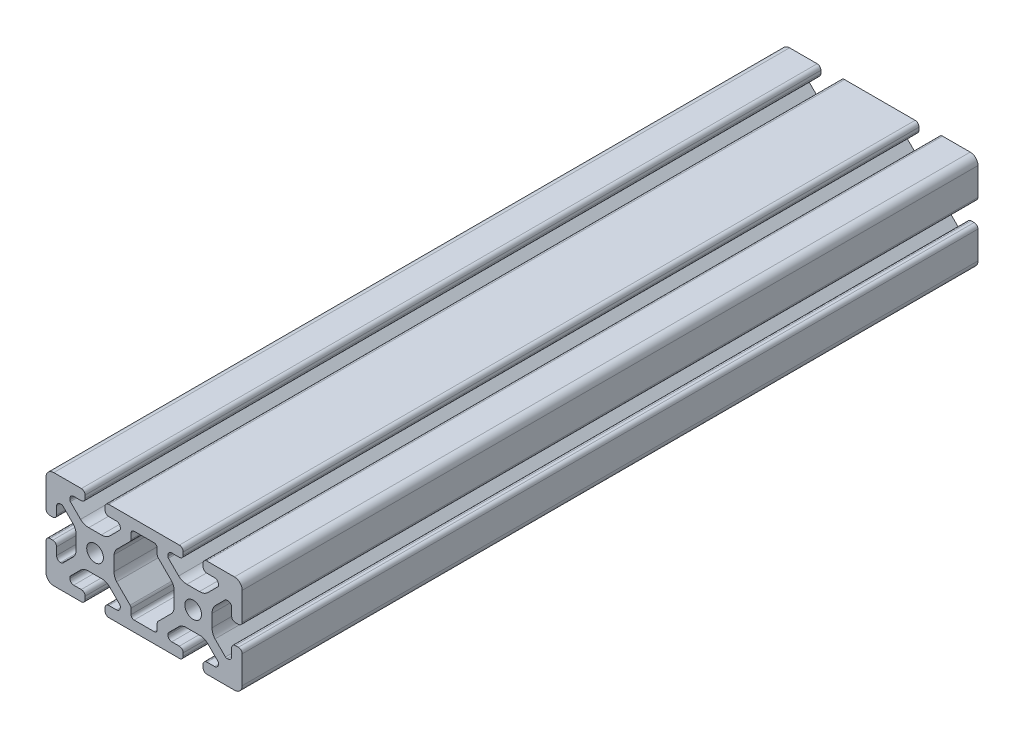
from build123d import *

# Parameters (mm, degrees)
SKETCH1_R      = 3.4
EXTRUDE1_DEPTH = 300


with BuildPart() as part:
    # Sketch1 → Extrude1 (new body)
    with BuildSketch(Plane.XY):
        with BuildLine():
            Line((-34.371895096, 20), (-5.628104904, 20))
            ThreePointArc((-5.628104904, 20), (-4.49100916, 19.51254943), (-4.06, 18.352883145))
            Line((-4.06, 18.352883145), (-4.06, 17.172883145))
            ThreePointArc((-4.06, 17.172883145), (-4.546241568, 16.112250378), (-5.63, 15.68))
            Line((-5.63, 15.68), (-8.715, 15.68))
            ThreePointArc((-8.715, 15.68), (-9.825157646, 15.220157646), (-10.285, 14.11))
            Line((-10.285, 14.11), (-10.285, 13.654503602))
            ThreePointArc((-10.285, 13.654503602), (-10.227148445, 13.363664194), (-10.062401154, 13.117102448))
            Line((-10.062401154, 13.117102448), (-5.908127218, 8.962828513))
            ThreePointArc((-5.908127218, 8.962828513), (-4.352583366, 8.002049766), (-2.549370008, 7.7))
            Line((-2.549370008, 7.7), (2.549370008, 7.7))
            ThreePointArc((2.549370008, 7.7), (4.352583366, 8.002049766), (5.908127218, 8.962828513))
            Line((5.908127218, 8.962828513), (10.062401154, 13.117102448))
            ThreePointArc((10.062401154, 13.117102448), (10.227148445, 13.363664194), (10.285, 13.654503602))
            Line((10.285, 13.654503602), (10.285, 14.11))
            ThreePointArc((10.285, 14.11), (9.825157646, 15.220157646), (8.715, 15.68))
            Line((8.715, 15.68), (5.63, 15.68))
            ThreePointArc((5.63, 15.68), (4.519842354, 16.139842354), (4.06, 17.25))
            Line((4.06, 17.25), (4.06, 18.431164164))
            ThreePointArc((4.06, 18.431164164), (4.498672143, 19.519739968), (5.569550674, 20))
            Line((5.569550674, 20), (13, 20))
            Line((13, 20), (16.83, 20))
            ThreePointArc((16.83, 20), (19.067780363, 19.075288119), (20, 16.840624931))
            Line((20, 16.840624931), (20, 13.010624931))
            Line((20, 13.010624931), (20, 5.582508737))
            ThreePointArc((20, 5.582508737), (19.486387554, 4.464397964), (18.324306777, 4.06))
            Line((18.324306777, 4.06), (17.144306789, 4.06))
            ThreePointArc((17.144306789, 4.06), (16.103082753, 4.554299861), (15.68, 5.626438298))
            Line((15.68, 5.626438298), (15.68, 8.711438298))
            ThreePointArc((15.68, 8.711438298), (15.220157646, 9.821595945), (14.11, 10.281438298))
            Line((14.11, 10.281438298), (13.650941901, 10.281438298))
            ThreePointArc((13.650941901, 10.281438298), (13.360102492, 10.223586743), (13.113540747, 10.058839452))
            Line((13.113540747, 10.058839452), (9.01112516, 5.956423865))
            ThreePointArc((9.01112516, 5.956423865), (8.027864944, 4.392105869), (7.715866667, 2.570966522))
            Line((7.715866667, 2.570966522), (7.715866667, -2.502014759))
            ThreePointArc((7.715866667, -2.502014759), (7.988460835, -4.298258683), (8.915473265, -5.86077197))
            Line((8.915473265, -5.86077197), (13.171894658, -10.117193363))
            ThreePointArc((13.171894658, -10.117193363), (13.418456403, -10.281940654), (13.709295811, -10.339792209))
            Line((13.709295811, -10.339792209), (14.110956402, -10.339792209))
            ThreePointArc((14.110956402, -10.339792209), (15.240319888, -9.860405851), (15.68, -8.714999999))
            Line((15.68, -8.714999999), (15.68, -5.629999999))
            ThreePointArc((15.68, -5.629999999), (16.139842353, -4.519842353), (17.249999999, -4.06))
            Line((17.249999999, -4.06), (18.431164165, -4.06))
            ThreePointArc((18.431164165, -4.06), (19.519739968, -4.498672143), (20, -5.569550674))
            Line((20, -5.569550674), (20, -13))
            Line((20, -13), (20, -16.83))
            ThreePointArc((20, -16.83), (19.153330856, -18.99480488), (17.057427332, -20))
            Line((17.057427332, -20), (13.227427332, -20))
            Line((13.227427332, -20), (5.796978006, -20))
            ThreePointArc((5.796978006, -20), (4.580537154, -19.606606664), (4.06, -18.438904761))
            Line((4.06, -18.438904761), (4.06, -17.25))
            ThreePointArc((4.06, -17.25), (4.519842354, -16.139842354), (5.63, -15.68))
            Line((5.63, -15.68), (8.715, -15.68))
            ThreePointArc((8.715, -15.68), (9.825157646, -15.220157646), (10.285, -14.11))
            Line((10.285, -14.11), (10.285, -13.654503602))
            ThreePointArc((10.285, -13.654503602), (10.227148445, -13.363664194), (10.062401154, -13.117102448))
            Line((10.062401154, -13.117102448), (6.309520343, -9.364221638))
            ThreePointArc((6.309520343, -9.364221638), (4.979669869, -8.257223741), (3.341546451, -7.7))
            Line((3.341546451, -7.7), (-3.341546451, -7.7))
            ThreePointArc((-3.341546451, -7.7), (-4.979669869, -8.257223741), (-6.309520343, -9.364221638))
            Line((-6.309520343, -9.364221638), (-10.062401154, -13.117102448))
            ThreePointArc((-10.062401154, -13.117102448), (-10.227148445, -13.363664194), (-10.285, -13.654503602))
            Line((-10.285, -13.654503602), (-10.285, -14.11))
            ThreePointArc((-10.285, -14.11), (-9.825157646, -15.220157646), (-8.715, -15.68))
            Line((-8.715, -15.68), (-5.63, -15.68))
            ThreePointArc((-5.63, -15.68), (-4.519842354, -16.139842354), (-4.06, -17.25))
            Line((-4.06, -17.25), (-4.06, -18.43))
            ThreePointArc((-4.06, -18.43), (-4.519842354, -19.540157646), (-5.63, -20))
            Line((-5.63, -20), (-14.00899397, -20))
            Line((-14.00899397, -20), (-21.780052417, -20))
            Line((-21.780052417, -20), (-25.99100603, -20))
            Line((-25.99100603, -20), (-34.37, -20))
            ThreePointArc((-34.37, -20), (-35.480157646, -19.540157646), (-35.94, -18.43))
            Line((-35.94, -18.43), (-35.94, -17.25))
            ThreePointArc((-35.94, -17.25), (-35.480157646, -16.139842354), (-34.37, -15.68))
            Line((-34.37, -15.68), (-31.285, -15.68))
            ThreePointArc((-31.285, -15.68), (-30.174842354, -15.220157646), (-29.715, -14.11))
            Line((-29.715, -14.11), (-29.715, -13.654503602))
            ThreePointArc((-29.715, -13.654503602), (-29.772851555, -13.363664194), (-29.937598846, -13.117102448))
            Line((-29.937598846, -13.117102448), (-33.690479657, -9.364221638))
            ThreePointArc((-33.690479657, -9.364221638), (-35.020330131, -8.257223741), (-36.658453549, -7.7))
            Line((-36.658453549, -7.7), (-43.341546451, -7.7))
            ThreePointArc((-43.341546451, -7.7), (-44.979669869, -8.257223741), (-46.309520343, -9.364221638))
            Line((-46.309520343, -9.364221638), (-50.062401154, -13.117102448))
            ThreePointArc((-50.062401154, -13.117102448), (-50.227148445, -13.363664194), (-50.285, -13.654503602))
            Line((-50.285, -13.654503602), (-50.285, -14.11))
            ThreePointArc((-50.285, -14.11), (-49.825157646, -15.220157646), (-48.715, -15.68))
            Line((-48.715, -15.68), (-45.63, -15.68))
            ThreePointArc((-45.63, -15.68), (-44.519842354, -16.139842354), (-44.06, -17.25))
            Line((-44.06, -17.25), (-44.06, -18.438904761))
            ThreePointArc((-44.06, -18.438904761), (-44.580537154, -19.606606664), (-45.796978006, -20))
            Line((-45.796978006, -20), (-53.227427332, -20))
            Line((-53.227427332, -20), (-57.057427332, -20))
            ThreePointArc((-57.057427332, -20), (-59.153330856, -18.99480488), (-60, -16.83))
            Line((-60, -16.83), (-60, -13))
            Line((-60, -13), (-60, -5.569550674))
            ThreePointArc((-60, -5.569550674), (-59.519739962, -4.498672137), (-58.431164149, -4.06))
            Line((-58.431164149, -4.06), (-57.249999999, -4.06))
            ThreePointArc((-57.249999999, -4.06), (-56.139842353, -4.519842353), (-55.68, -5.629999999))
            Line((-55.68, -5.629999999), (-55.68, -8.714999999))
            ThreePointArc((-55.68, -8.714999999), (-55.240319888, -9.860405851), (-54.110956402, -10.339792209))
            Line((-54.110956402, -10.339792209), (-53.709295811, -10.339792209))
            ThreePointArc((-53.709295811, -10.339792209), (-53.418456403, -10.281940654), (-53.171894658, -10.117193363))
            Line((-53.171894658, -10.117193363), (-48.915473265, -5.86077197))
            ThreePointArc((-48.915473265, -5.86077197), (-47.988460835, -4.298258683), (-47.715866667, -2.502014759))
            Line((-47.715866667, -2.502014759), (-47.715866667, 2.570966522))
            ThreePointArc((-47.715866667, 2.570966522), (-48.027864944, 4.392105869), (-49.01112516, 5.956423865))
            Line((-49.01112516, 5.956423865), (-53.113540747, 10.058839452))
            ThreePointArc((-53.113540747, 10.058839452), (-53.360102492, 10.223586743), (-53.650941901, 10.281438298))
            Line((-53.650941901, 10.281438298), (-54.11, 10.281438298))
            ThreePointArc((-54.11, 10.281438298), (-55.220157646, 9.821595945), (-55.68, 8.711438298))
            Line((-55.68, 8.711438298), (-55.68, 5.626438298))
            ThreePointArc((-55.68, 5.626438298), (-56.103082753, 4.554299861), (-57.144306789, 4.06))
            Line((-57.144306789, 4.06), (-58.324306777, 4.06))
            ThreePointArc((-58.324306777, 4.06), (-59.486387554, 4.464397964), (-60, 5.582508737))
            Line((-60, 5.582508737), (-60, 13.010624931))
            Line((-60, 13.010624931), (-60, 16.840624931))
            ThreePointArc((-60, 16.840624931), (-59.067780363, 19.075288119), (-56.83, 20))
            Line((-56.83, 20), (-53, 20))
            Line((-53, 20), (-45.569550674, 20))
            ThreePointArc((-45.569550674, 20), (-44.498672143, 19.519739968), (-44.06, 18.431164164))
            Line((-44.06, 18.431164164), (-44.06, 17.25))
            ThreePointArc((-44.06, 17.25), (-44.519842354, 16.139842354), (-45.63, 15.68))
            Line((-45.63, 15.68), (-48.715, 15.68))
            ThreePointArc((-48.715, 15.68), (-49.825157646, 15.220157646), (-50.285, 14.11))
            Line((-50.285, 14.11), (-50.285, 13.654503602))
            ThreePointArc((-50.285, 13.654503602), (-50.227148445, 13.363664194), (-50.062401154, 13.117102448))
            Line((-50.062401154, 13.117102448), (-45.908127218, 8.962828513))
            ThreePointArc((-45.908127218, 8.962828513), (-44.352583366, 8.002049766), (-42.549370008, 7.7))
            Line((-42.549370008, 7.7), (-37.450629992, 7.7))
            ThreePointArc((-37.450629992, 7.7), (-35.647416634, 8.002049766), (-34.091872782, 8.962828513))
            Line((-34.091872782, 8.962828513), (-29.937598846, 13.117102448))
            ThreePointArc((-29.937598846, 13.117102448), (-29.772851555, 13.363664194), (-29.715, 13.654503602))
            Line((-29.715, 13.654503602), (-29.715, 14.11))
            ThreePointArc((-29.715, 14.11), (-30.174842354, 15.220157646), (-31.285, 15.68))
            Line((-31.285, 15.68), (-34.37, 15.68))
            ThreePointArc((-34.37, 15.68), (-35.453758432, 16.112250378), (-35.94, 17.172883145))
            Line((-35.94, 17.172883145), (-35.94, 18.352883145))
            ThreePointArc((-35.94, 18.352883145), (-35.50899084, 19.51254943), (-34.371895096, 20))
        make_face()
        with Locations((-40, 0)):
            Circle(SKETCH1_R, mode=Mode.SUBTRACT)
        with Locations(Location((0, 0, 0), (0, 0, 180))):
            Circle(SKETCH1_R, mode=Mode.SUBTRACT)
        with BuildLine():
            Line((-15.928248833, 15.68), (-24.071751167, 15.68))
            ThreePointArc((-24.071751167, 15.68), (-24.969776779, 15.308025612), (-25.341751167, 14.41))
            Line((-25.341751167, 14.41), (-25.341751167, 12.129598762))
            ThreePointArc((-25.341751167, 12.129598762), (-25.438424161, 11.643590803), (-25.713725555, 11.23157315))
            Line((-25.713725555, 11.23157315), (-30.598777023, 6.346521682))
            ThreePointArc((-30.598777023, 6.346521682), (-31.737774423, 4.964558417), (-32.284133333, 3.259087959))
            Line((-32.284133333, 3.259087959), (-32.284133333, -2.724972544))
            ThreePointArc((-32.284133333, -2.724972544), (-32.005210609, -4.328708179), (-31.201199443, -5.744099262))
            Line((-31.201199443, -5.744099262), (-25.713725555, -11.23157315))
            ThreePointArc((-25.713725555, -11.23157315), (-25.438424161, -11.643590803), (-25.341751167, -12.129598762))
            Line((-25.341751167, -12.129598762), (-25.341751167, -14.41))
            ThreePointArc((-25.341751167, -14.41), (-24.969776779, -15.308025612), (-24.071751167, -15.68))
            Line((-24.071751167, -15.68), (-15.928248833, -15.68))
            ThreePointArc((-15.928248833, -15.68), (-15.030223221, -15.308025612), (-14.658248833, -14.41))
            Line((-14.658248833, -14.41), (-14.658248833, -12.129598762))
            ThreePointArc((-14.658248833, -12.129598762), (-14.561575839, -11.643590803), (-14.286274445, -11.23157315))
            Line((-14.286274445, -11.23157315), (-8.798800557, -5.744099262))
            ThreePointArc((-8.798800557, -5.744099262), (-7.994789391, -4.328708179), (-7.715866667, -2.724972544))
            Line((-7.715866667, -2.724972544), (-7.715866667, 3.259087959))
            ThreePointArc((-7.715866667, 3.259087959), (-8.262225577, 4.964558417), (-9.401222977, 6.346521682))
            Line((-9.401222977, 6.346521682), (-14.286274445, 11.23157315))
            ThreePointArc((-14.286274445, 11.23157315), (-14.561575839, 11.643590803), (-14.658248833, 12.129598762))
            Line((-14.658248833, 12.129598762), (-14.658248833, 14.41))
            ThreePointArc((-14.658248833, 14.41), (-15.030223221, 15.308025612), (-15.928248833, 15.68))
        make_face(mode=Mode.SUBTRACT)
    extrude(amount=-EXTRUDE1_DEPTH)


solid = part.part
